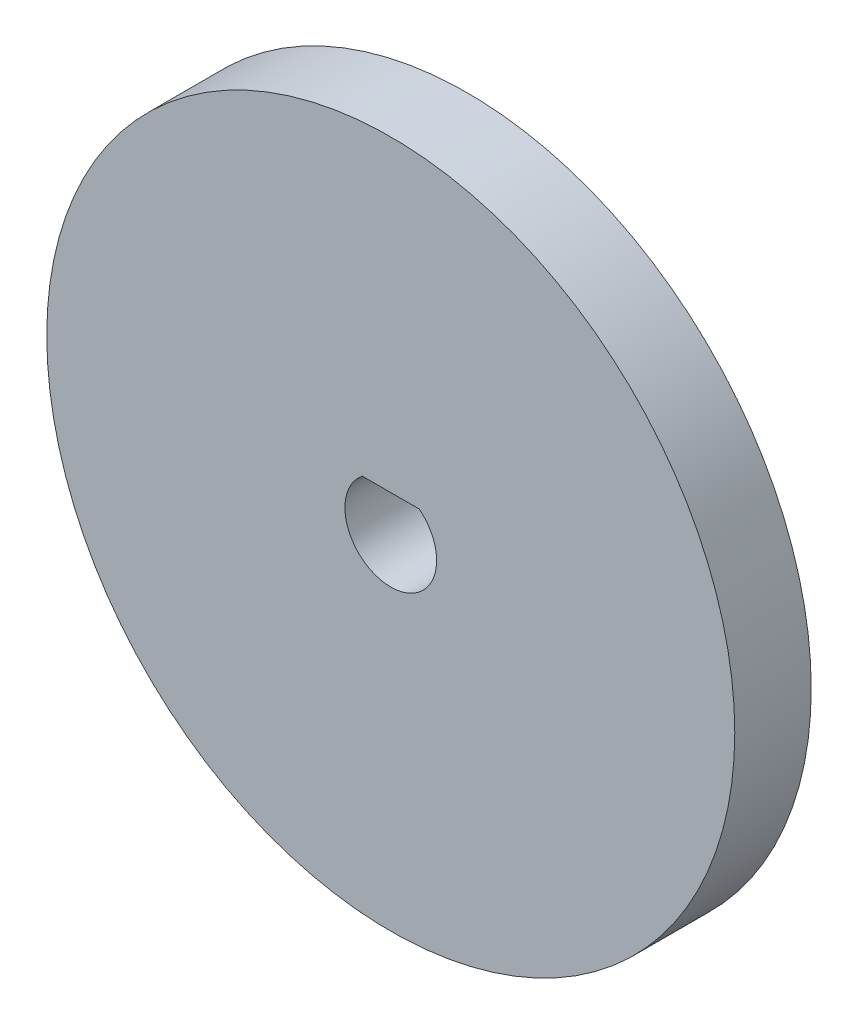
from build123d import *

# Parameters (mm, degrees)
SKETCH1_R           = 22.5
BOSS_EXTRUDE1_DEPTH = 5


with BuildPart() as part:
    # Sketch1 → Boss-Extrude1 (new body)
    with BuildSketch(Plane.XY):
        Circle(SKETCH1_R)
        with BuildLine():
            Line((-1.86480562, 2.35), (1.86480562, 2.35))
            ThreePointArc((1.86480562, 2.35), (0, -3), (-1.86480562, 2.35))
        make_face(mode=Mode.SUBTRACT)
    extrude(amount=BOSS_EXTRUDE1_DEPTH)


solid = part.part
